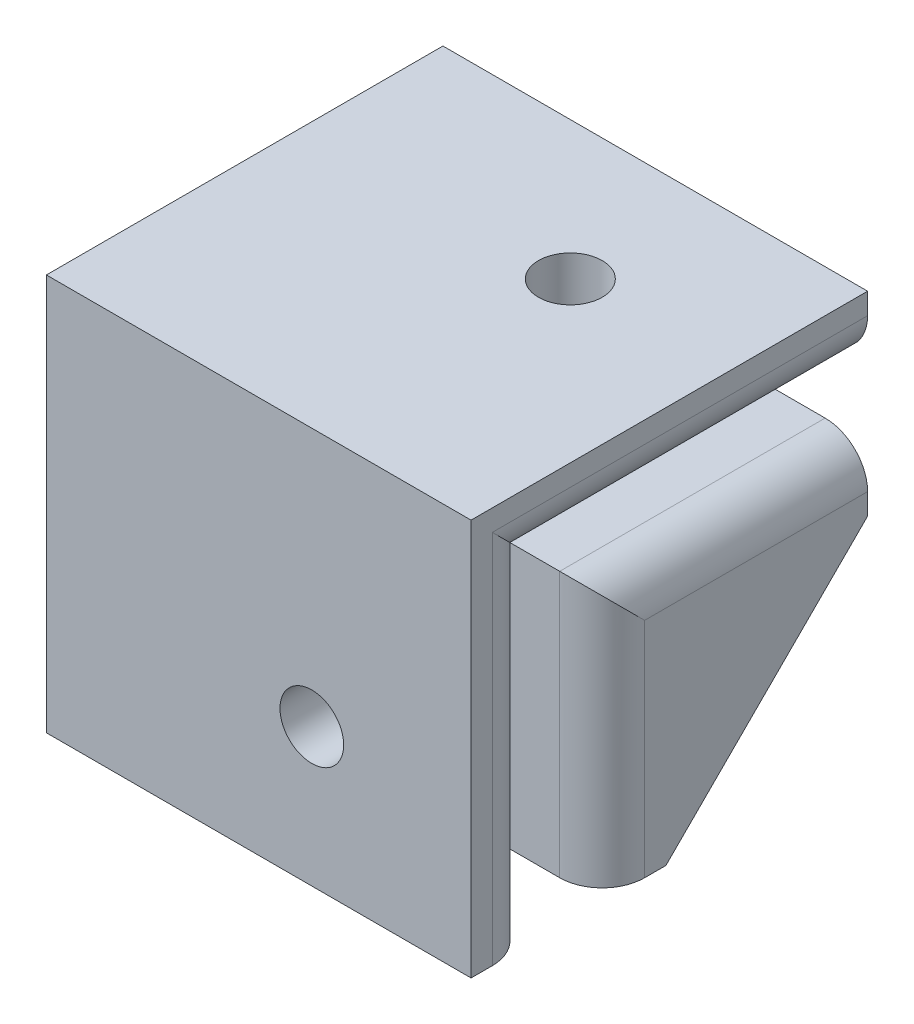
from build123d import *

# Parameters (mm, degrees)
BOSS_EXTRUDE1_DEPTH = 20
CUT_EXTRUDE1_DEPTH  = 15
FILLET1_R           = 2
SKETCH3_R           = 1.5
CUT_EXTRUDE2_DEPTH  = 31.083311404
SKETCH4_R           = 1.5
CUT_EXTRUDE3_DEPTH  = 31.083311404


with BuildPart() as part:
    # Sketch1 → Boss-Extrude1 (new body)
    with BuildSketch(Plane(origin=(0, 0, 0), x_dir=(0, 0, -1), z_dir=(1, 0, 0))):
        Polygon((0, -12.5), (-3.175, -12.5), (-6.175, -12.5), (-6.175, 6.175), (12.5, 6.175), (12.5, 3.175), (12.5, 0), (12.5, -3), (3, -12.5), align=None)
    extrude(amount=BOSS_EXTRUDE1_DEPTH)

    # Sketch2 → Cut-Extrude1 (cut)
    with BuildSketch(Plane(origin=(20, 0, 0), x_dir=(0, 0, -1), z_dir=(1, 0, 0))):
        Polygon((-3.175, -12.5), (0, -12.5), (0, 0), (12.5, 0), (12.5, 3.175), (-3.175, 3.175), align=None)
    extrude(amount=-CUT_EXTRUDE1_DEPTH, mode=Mode.SUBTRACT)

    # Fillet1
    fillet1_edges = [part.edges().sort_by_distance(p)[0] for p in [
        (20, -4.6625, 3.175),
        (20, -6.25, 0),
        (20, 0, -6.25),
        (20, 3.175, -4.6625),
    ]]
    fillet(fillet1_edges, radius=FILLET1_R)

    # Sketch3 → Cut-Extrude2 (cut, through all)
    with BuildSketch(Plane(origin=(0, 6.175, 0), x_dir=(1, 0, 0), z_dir=(0, 1, 0))):
        with Locations(Location((12.5, 6, 0), (0, 0, 90))):
            Circle(SKETCH3_R)
    extrude(amount=-CUT_EXTRUDE2_DEPTH, mode=Mode.SUBTRACT)

    # Sketch4 → Cut-Extrude3 (cut, through all)
    with BuildSketch(Plane.XY.offset(6.175)):
        with Locations((12.5, -6)):
            Circle(SKETCH4_R)
    extrude(amount=-CUT_EXTRUDE3_DEPTH, mode=Mode.SUBTRACT)


solid = part.part
